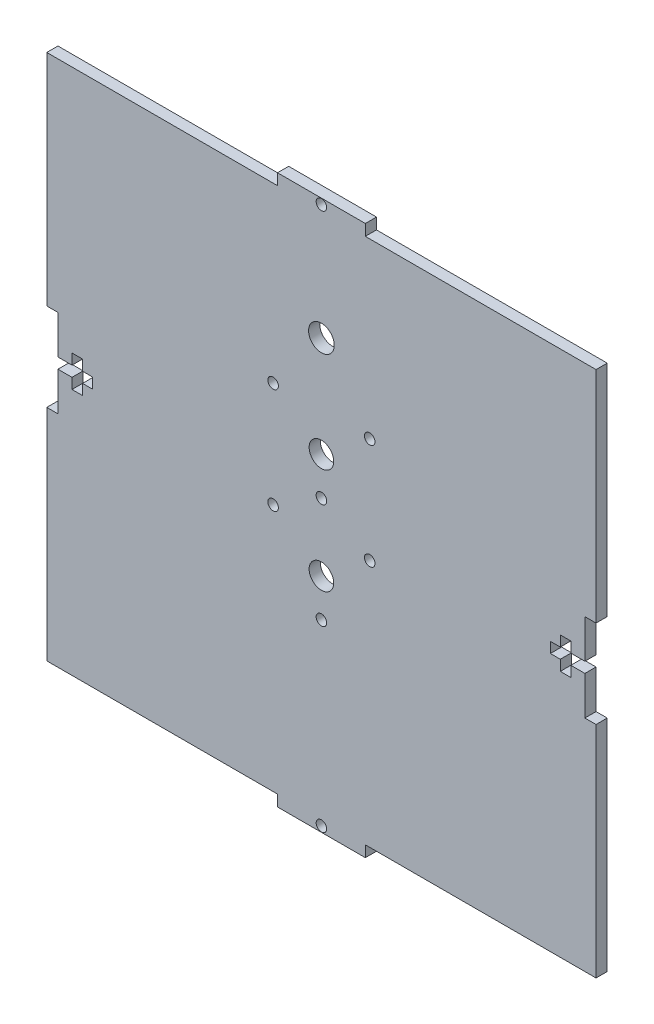
from build123d import *

# Parameters (mm, degrees)
SKETCH1_R           = 1.5
BOSS_EXTRUDE1_DEPTH = 3.18
SKETCH2_R           = 1.5
SKETCH2_R_2         = 3.5
CUT_EXTRUDE1_DEPTH  = 10
SKETCH3_R           = 3.656100146
CUT_EXTRUDE2_DEPTH  = 10


with BuildPart() as part:
    # Sketch1 → Boss-Extrude1 (new body)
    with BuildSketch(Plane.XY):
        Polygon((-78.18, 75), (-12.5, 75), (-12.5, 78.18), (12.5, 78.18), (12.5, 75), (78.18, 75), (78.18, 12.5), (75, 12.5), (75, 1.5), (71, 1.5), (71, 4.5), (68, 4.5), (68, 1.5), (65.18, 1.5), (65.18, -1.5), (68, -1.5), (68, -4.5), (71, -4.5), (71, -1.5), (75, -1.5), (75, -12.5), (78.18, -12.5), (78.18, -75), (12.5, -75), (12.5, -78.18), (-12.5, -78.18), (-12.5, -75), (-78.18, -75), (-78.18, -12.5), (-75, -12.5), (-75, -1.5), (-71, -1.5), (-71, -4.5), (-68, -4.5), (-68, -1.5), (-65.18, -1.5), (-65.18, 1.5), (-68, 1.5), (-68, 4.5), (-71, 4.5), (-71, 1.5), (-75, 1.5), (-75, 12.5), (-78.18, 12.5), align=None)
        with Locations(Location((0, -76.59, 0), (0, 0, 180))):
            Circle(SKETCH1_R, mode=Mode.SUBTRACT)
        with Locations(Location((0, 76.59, 0), (0, 0, 180))):
            Circle(SKETCH1_R, mode=Mode.SUBTRACT)
    extrude(amount=BOSS_EXTRUDE1_DEPTH)

    # Sketch2 → Cut-Extrude1 (cut)
    with BuildSketch(Plane.XY.offset(3.18)):
        with Locations((-13.75, -4.3)):
            Circle(SKETCH2_R)
        with Locations((0, -25.8)):
            Circle(SKETCH2_R)
        with Locations((13.75, -4.3)):
            Circle(SKETCH2_R)
        with Locations((0, 4.2)):
            Circle(SKETCH2_R)
        with Locations((13.75, 25.7)):
            Circle(SKETCH2_R)
        with Locations((-13.75, 25.7)):
            Circle(SKETCH2_R)
        with Locations((0, 15)):
            Circle(SKETCH2_R_2)
        with Locations((0, -15)):
            Circle(SKETCH2_R_2)
    extrude(amount=-CUT_EXTRUDE1_DEPTH, mode=Mode.SUBTRACT)

    # Sketch3 → Cut-Extrude2 (cut)
    with BuildSketch(Plane(origin=(0, 0, 0), x_dir=(-1, 0, 0), z_dir=(0, 0, -1))):
        with Locations((1e-09, 43.7)):
            Circle(SKETCH3_R)
    extrude(amount=-CUT_EXTRUDE2_DEPTH, mode=Mode.SUBTRACT)


solid = part.part
